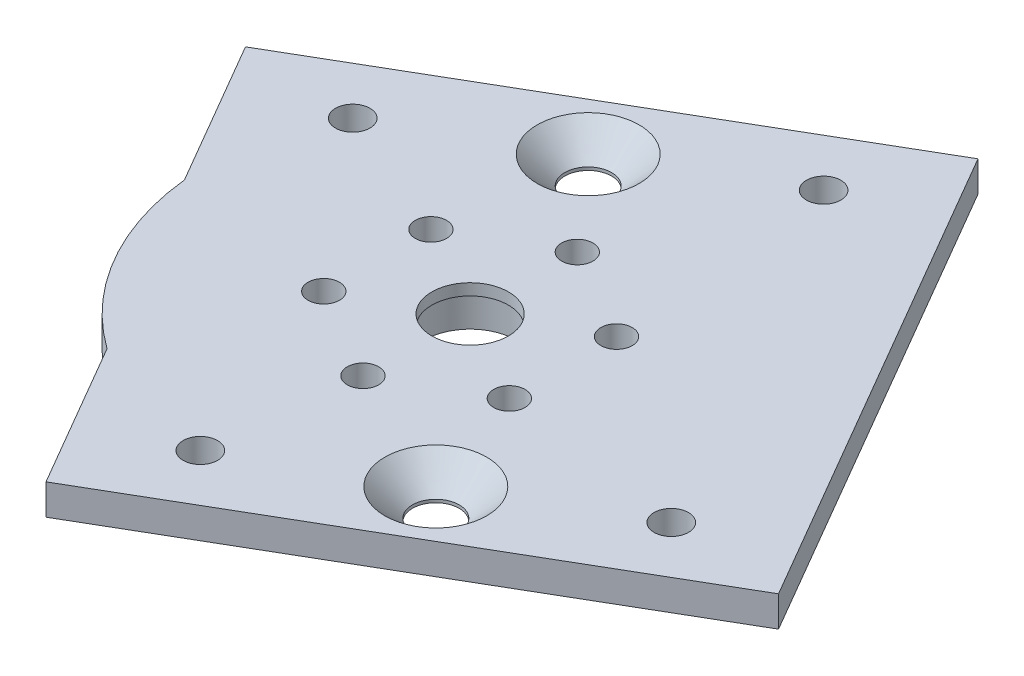
from build123d import *

# Parameters (mm, degrees)
SKETCH_1_R          = 34
SKETCH_1_R_2        = 2.05
SKETCH_1_R_3        = 6
EXTRUDE_1_DEPTH     = 4
SKETCH_5_R          = 6.5
SKETCH_5_R_2        = 5
EXTRUDE_4_DEPTH     = 1.5
EXTRUDE_START       = 2
SKETCH_6_R          = 7
SKETCH_6_R_2        = 6
EXTRUDE_5_DEPTH     = 2
EXTRUDE_START_2     = -4
EXTRUDE_6_DEPTH     = 4
SKETCH_9_R          = 2.25
SKETCH_9_R_2        = 3.05
CUT_EXTRUDE_1_DEPTH = 10
CHAMFER_2_SIZE      = 3.6
SKETCH_10_R         = 6.05
CUT_EXTRUDE_3_DEPTH = 4.5


with BuildPart() as part:
    # 草图1 → 凸台-拉伸1 (new body)
    with BuildSketch(Plane(origin=(0, 0, 0), x_dir=(1, 0, 0), z_dir=(0, 1, 0))):
        with Locations(Location((0, 0, 0), (0, 0, 270))):
            Circle(SKETCH_1_R)
        with Locations(Location((0, 14, 0), (0, 0, 270))):
            Circle(SKETCH_1_R_2, mode=Mode.SUBTRACT)
        with Locations(Location((12.124355653, 7, 0), (0, 0, 270))):
            Circle(SKETCH_1_R_2, mode=Mode.SUBTRACT)
        with Locations(Location((12.124355653, -7, 0), (0, 0, 270))):
            Circle(SKETCH_1_R_2, mode=Mode.SUBTRACT)
        with Locations(Location((0, -14, 0), (0, 0, 270))):
            Circle(SKETCH_1_R_2, mode=Mode.SUBTRACT)
        with Locations(Location((-12.124355653, -7, 0), (0, 0, 270))):
            Circle(SKETCH_1_R_2, mode=Mode.SUBTRACT)
        with Locations(Location((-12.124355653, 7, 0), (0, 0, 270))):
            Circle(SKETCH_1_R_2, mode=Mode.SUBTRACT)
        with Locations(Location((0, 0, 0), (0, 0, 270))):
            Circle(SKETCH_1_R_3, mode=Mode.SUBTRACT)
    extrude(amount=EXTRUDE_1_DEPTH)

    # 草图5 → 凸台-拉伸4 (add)
    with BuildSketch(Plane(origin=(0, 4, 0), x_dir=(1, 0, 0), z_dir=(0, 1, 0))):
        Circle(SKETCH_5_R)
        with Locations(Location((0, 0, 0), (0, 0, 270))):
            Circle(SKETCH_5_R_2, mode=Mode.SUBTRACT)
    extrude(amount=-EXTRUDE_4_DEPTH)

    # 草图6 → 凸台-拉伸5 (add)
    with BuildSketch(Plane(origin=(0, 0, 0), x_dir=(-1, 0, 0), z_dir=(0, -1, 0)).offset(EXTRUDE_START)):
        with Locations(Location((0, 0, 0), (0, 0, 270))):
            Circle(SKETCH_6_R)
        with Locations(Location((0, 0, 0), (0, 0, 90))):
            Circle(SKETCH_6_R_2, mode=Mode.SUBTRACT)
    extrude(amount=-EXTRUDE_5_DEPTH)

    # 草图8 → 凸台-拉伸6 (add)
    with BuildSketch(Plane(origin=(0, 4, 0), x_dir=(1, 0, 0), z_dir=(0, 1, 0)).offset(EXTRUDE_START_2)):
        with BuildLine():
            Line((-8.707638575, -46.70307303), (51.809561134, -11.522559398))
            Line((51.809561134, -11.522559398), (15.62388997, 50.723703159))
            Line((15.62388997, 50.723703159), (-44.893309739, 15.543189527))
            Line((-44.893309739, 15.543189527), (-33.818604688, -3.507417415))
            ThreePointArc((-33.818604688, -3.507417415), (-1.756052475, 33.954620889), (34, 0))
            ThreePointArc((34, 0), (15.546708924, -30.237391449), (-19.782343625, -27.652466087))
            Line((-19.782343625, -27.652466087), (-8.707638575, -46.70307303))
        make_face()
    extrude(amount=EXTRUDE_6_DEPTH)

    # 草图9 → 切除-拉伸1 (cut)
    with BuildSketch(Plane(origin=(0, 0, 0), x_dir=(-1, 0, 0), z_dir=(0, -1, 0))):
        with Locations(Location((-36.730998817, -10.456276868, 0), (0, 0, 90))):
            Circle(SKETCH_9_R)
        with Locations(Location((-9.089166677, 37.092951475, 0), (0, 0, 90))):
            Circle(SKETCH_9_R)
        with Locations(Location((-17.279041767, -21.764299107, 0), (0, 0, 90))):
            Circle(SKETCH_9_R_2)
        with Locations(Location((2.172915282, -33.072321345, 0), (0, 0, 90))):
            Circle(SKETCH_9_R)
        with Locations(Location((29.814747421, 14.476906997, 0), (0, 0, 90))):
            Circle(SKETCH_9_R)
        with Locations(Location((10.362790372, 25.784929236, 0), (0, 0, 90))):
            Circle(SKETCH_9_R_2)
    extrude(amount=-CUT_EXTRUDE_1_DEPTH, mode=Mode.SUBTRACT)

    # 倒角2
    chamfer_2_edges = [part.edges().sort_by_distance(p)[0] for p in [
        (17.279041767, 4, 24.814299107),
        (-10.362790372, 4, -22.734929236),
    ]]
    chamfer(chamfer_2_edges, length=CHAMFER_2_SIZE)

    # 草图10 → 切除-拉伸3 (cut)
    with BuildSketch(Plane(origin=(0, -2, 0), x_dir=(-1, 0, 0), z_dir=(0, -1, 0))):
        with Locations(Location((0, 0, 0), (0, 0, 90))):
            Circle(SKETCH_10_R)
    extrude(amount=-CUT_EXTRUDE_3_DEPTH, mode=Mode.SUBTRACT)


solid = part.part
